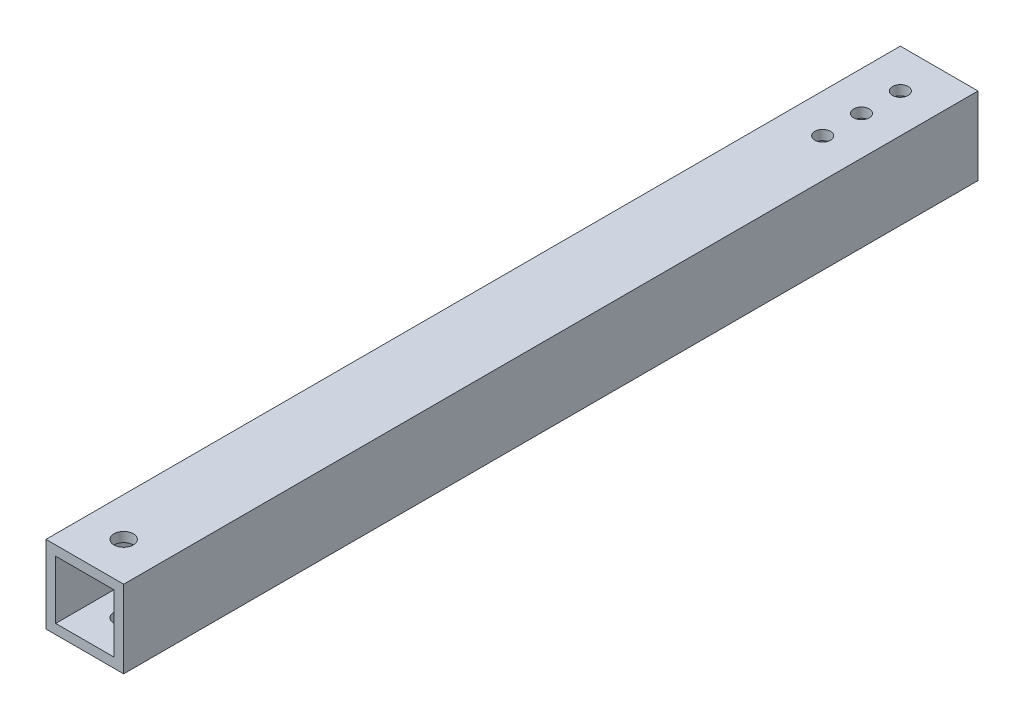
from build123d import *

# Parameters (mm, degrees)
SKETCH1_W               = 25.4
SKETCH1_H               = 25.4
SKETCH1_W_2             = 19.05
SKETCH1_H_2             = 19.05
BOSS_EXTRUDE1_DEPTH     = 279.4
CUT_EXTRUDE1_DEPTH      = 282.699627263
CUT_EXTRUDE1_DEPTH_BACK = 282.699627263
SKETCH2_R               = 3.175
F_10_CLEARANCE_HOLE1_D  = 5.1054


with BuildPart() as part:
    # Sketch1 → Boss-Extrude1 (new body)
    with BuildSketch(Plane.XY):
        with Locations((-12.7, 12.7)):
            Rectangle(SKETCH1_W, SKETCH1_H)
        with Locations((-12.7, 12.7)):
            Rectangle(SKETCH1_W_2, SKETCH1_H_2, mode=Mode.SUBTRACT)
    extrude(amount=BOSS_EXTRUDE1_DEPTH)

    # Sketch2 → Cut-Extrude1 (cut, two sides: drawn at the far end of the back side and taken through both)
    with BuildSketch(Plane(origin=(0, 0, 0), x_dir=(-1, 0, 0), z_dir=(0, -1, 0)).offset(-CUT_EXTRUDE1_DEPTH_BACK)):
        with Locations(Location((12.7, -266.7, 0), (0, 0, 90))):
            Circle(SKETCH2_R)
    extrude(amount=CUT_EXTRUDE1_DEPTH + CUT_EXTRUDE1_DEPTH_BACK, mode=Mode.SUBTRACT)

    # #10 Clearance Hole1 (through all)
    with Locations(Plane(origin=(0, 25.4, 0), x_dir=(1, 0, 0), z_dir=(0, 1, 0))):
        with Locations((-12.7, -38.1), (-12.7, -25.4), (-12.7, -12.7)):
            Hole(F_10_CLEARANCE_HOLE1_D / 2)


solid = part.part
